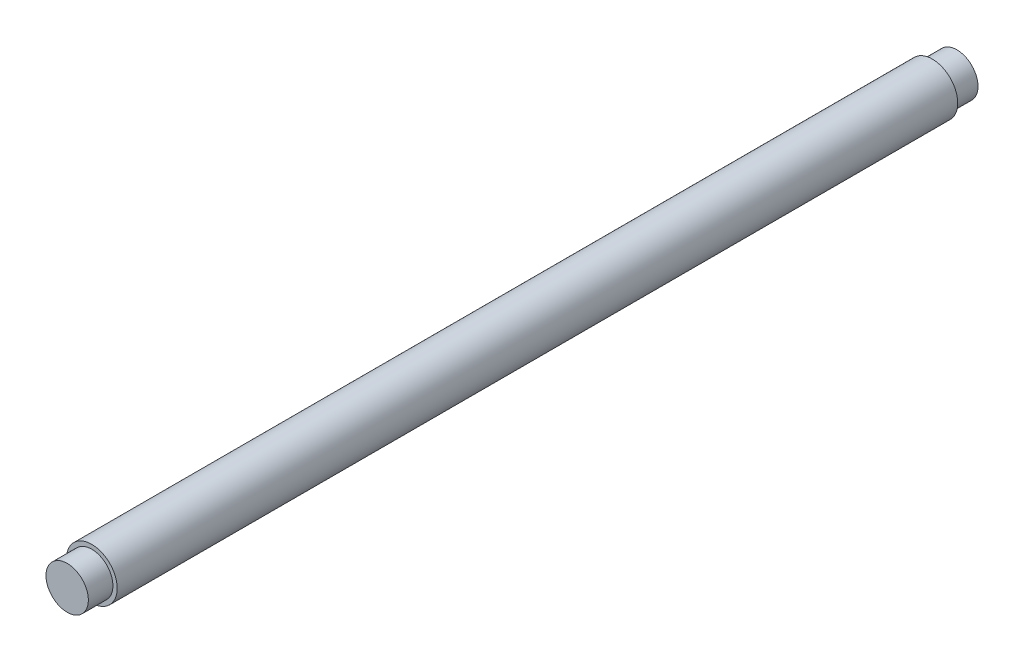
from build123d import *

# Parameters (mm, degrees)
SKETCH_1_R          = 6
EXTRUDE_1_DEPTH     = 105
CUT_EXTRUDE_START   = -5.8
SKETCH_2_R          = 6
SKETCH_2_R_2        = 5
CUT_EXTRUDE_1_DEPTH = 5.8


with BuildPart() as part:
    # ｽｹｯﾁ1 → ﾎﾞｽ - 押し出し1 (new, symmetric)
    with BuildSketch(Plane.XY):
        Circle(SKETCH_1_R)
    extrude(amount=EXTRUDE_1_DEPTH, both=True)

    # ｽｹｯﾁ2 → ｶｯﾄ - 押し出し1 (cut)
    with BuildSketch(Plane(origin=(0, 0, -105), x_dir=(-1, 0, 0), z_dir=(0, 0, -1)).offset(CUT_EXTRUDE_START)):
        Circle(SKETCH_2_R)
        Circle(SKETCH_2_R_2, mode=Mode.SUBTRACT)
    cut_extrude_1 = extrude(amount=CUT_EXTRUDE_1_DEPTH, mode=Mode.SUBTRACT)

    # ﾐﾗｰ1: ｶｯﾄ - 押し出し1 across plane
    add(cut_extrude_1.mirror(Plane.XY), mode=Mode.SUBTRACT)


solid = part.part
